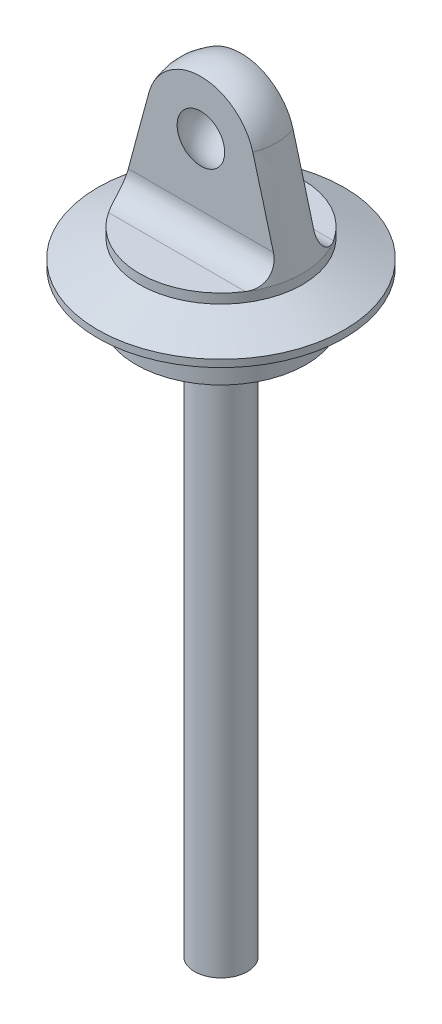
from build123d import *

# Parameters (mm, degrees)
CUT_EXTRUDE1_DEPTH = 25


with BuildPart() as part:
    # Sketch1 → Revolve1 (revolve)
    with BuildSketch(Plane.XY, mode=Mode.PRIVATE) as revolve1_sk:
        with BuildLine():
            Line((0, -150), (-5.5, -150))
            Line((-5.5, -150), (-5.5, -34.1))
            Line((-5.5, -34.1), (-17.75, -34.1))
            Line((-17.75, -34.1), (-17.75, -25.3))
            Line((-17.75, -25.3), (-25.75, -25.3))
            Line((-25.75, -25.3), (-25.75, -23.8))
            Line((-25.75, -23.8), (-17, -20))
            Line((-17, -20), (-17, -18))
            Line((-17, -18), (-11.624443868, 2.97864143))
            ThreePointArc((-11.624443868, 2.97864143), (-7.357183661, 9.480076402), (0, 12))
            Line((0, 12), (0, -150))
        make_face()
    revolve(revolve1_sk.sketch.rotate(Axis((0, -150, 0), (0, 1, 0)), 180), axis=Axis((0, -150, 0), (0, 1, 0)))

    # Sketch2 → Cut-Extrude1 (cut, symmetric)
    with BuildSketch(Plane(origin=(0, 0, 0), x_dir=(0, 0, -1), z_dir=(1, 0, 0))):
        with BuildLine():
            Line((-4.2, 12.434179723), (-4.2, -13))
            ThreePointArc((-4.2, -13), (-5.664466094, -16.535533906), (-9.2, -18))
            Line((-9.2, -18), (-21.107877624, -18))
            Line((-21.107877624, -18), (-21.107877624, 12.434179723))
            Line((-21.107877624, 12.434179723), (-4.2, 12.434179723))
        make_face()
        with BuildLine():
            Line((21.107877624, 12.434179723), (4.2, 12.434179723))
            Line((4.2, 12.434179723), (4.2, -13))
            ThreePointArc((4.2, -13), (5.664466094, -16.535533906), (9.2, -18))
            Line((9.2, -18), (21.107877624, -18))
            Line((21.107877624, -18), (21.107877624, 12.434179723))
        make_face()
    extrude(amount=CUT_EXTRUDE1_DEPTH, both=True, mode=Mode.SUBTRACT)

    # Sketch3 → Cut-Revolve1 (revolve, cut)
    with BuildSketch(Plane.XY):
        with BuildLine():
            Line((0, -6.5), (0, 6.5))
            ThreePointArc((0, 6.5), (-6.5, 0), (0, -6.5))
        make_face()
    revolve(axis=Axis((0, -6.5, 0), (0, 1, 0)), mode=Mode.SUBTRACT)


solid = part.part
